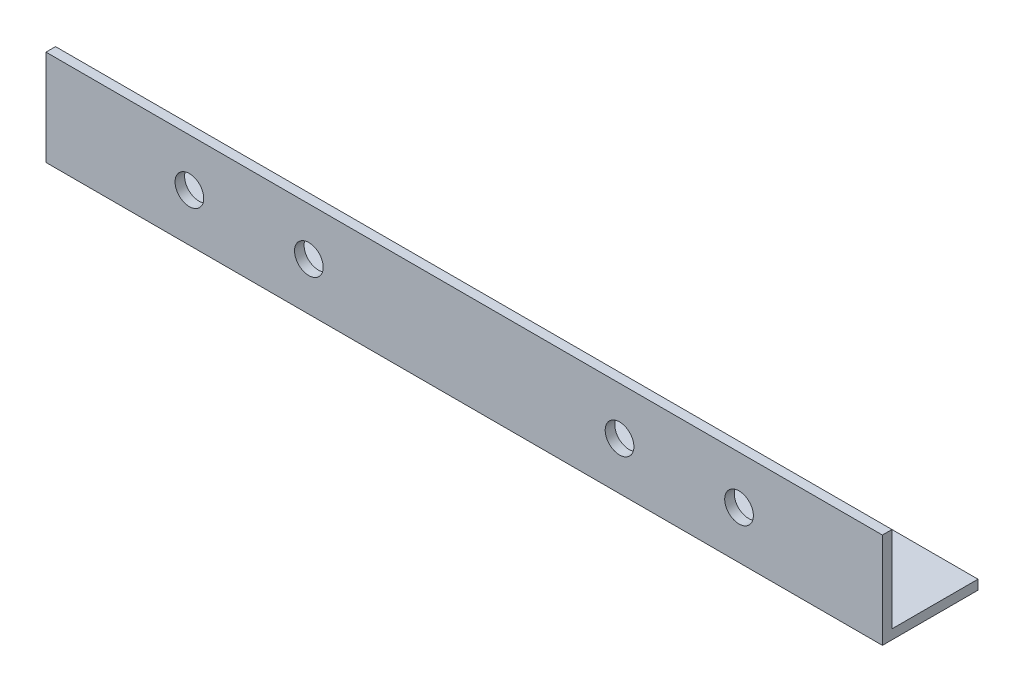
from build123d import *

# Parameters (mm, degrees)
EXTRUDE_1_DEPTH     = 350
SKETCH_2_R          = 6
CUT_EXTRUDE_1_DEPTH = 355.541958025
SKETCH_3_R          = 6
CUT_EXTRUDE_2_DEPTH = 355.541958025
SKETCH_4_R          = 6
CUT_EXTRUDE_3_DEPTH = 355.541958025
SKETCH_6_R          = 6
CUT_EXTRUDE_4_DEPTH = 355.541958025


with BuildPart() as part:
    # Эскиз1 → Бобышка-Вытянуть1 (new body)
    with BuildSketch(Plane(origin=(0, 0, 0), x_dir=(0, 0, -1), z_dir=(1, 0, 0))):
        Polygon((0, 0), (0, 40), (4, 40), (4, 4), (40, 4), (40, 0), align=None)
    extrude(amount=EXTRUDE_1_DEPTH)

    # Эскиз2 → Вырез-Вытянуть1 (cut, through all)
    with BuildSketch(Plane.XY):
        with Locations((60, 20)):
            Circle(SKETCH_2_R)
    extrude(amount=-CUT_EXTRUDE_1_DEPTH, mode=Mode.SUBTRACT)

    # Эскиз3 → Вырез-Вытянуть2 (cut, through all)
    with BuildSketch(Plane.XY):
        with Locations((290, 20)):
            Circle(SKETCH_3_R)
    extrude(amount=-CUT_EXTRUDE_2_DEPTH, mode=Mode.SUBTRACT)

    # Эскиз4 → Вырез-Вытянуть3 (cut, through all)
    with BuildSketch(Plane.XY):
        with Locations((240, 20)):
            Circle(SKETCH_4_R)
    extrude(amount=-CUT_EXTRUDE_3_DEPTH, mode=Mode.SUBTRACT)

    # Эскиз6 → Вырез-Вытянуть4 (cut, through all)
    with BuildSketch(Plane.XY):
        with Locations((110, 20)):
            Circle(SKETCH_6_R)
    extrude(amount=-CUT_EXTRUDE_4_DEPTH, mode=Mode.SUBTRACT)


solid = part.part
